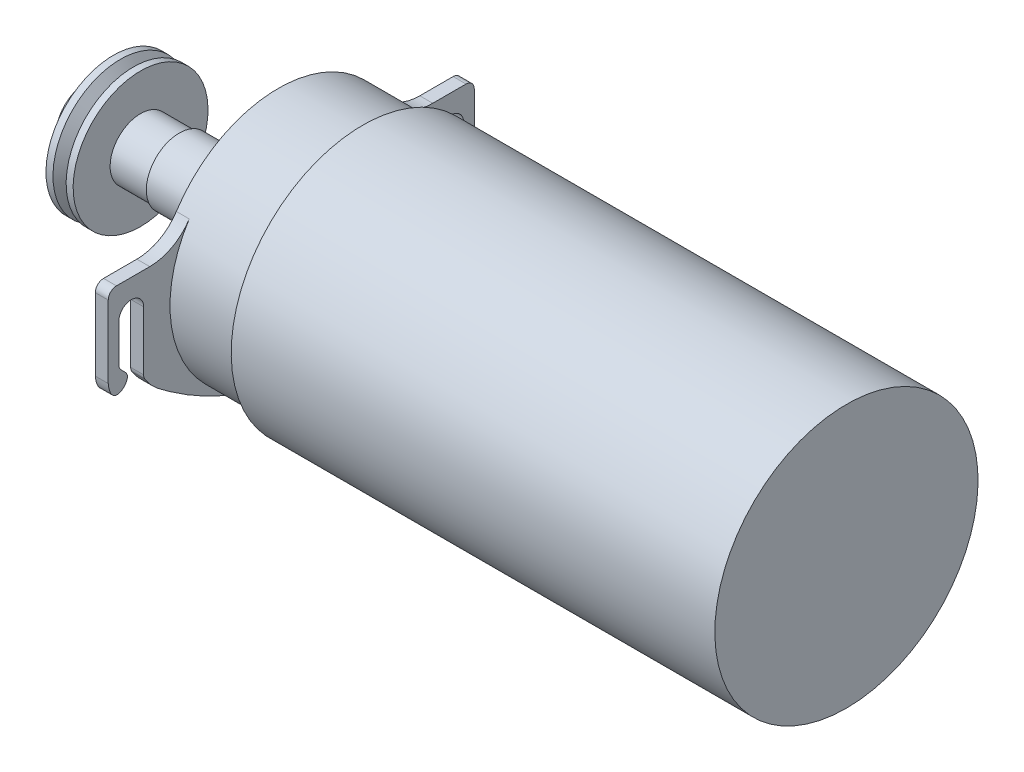
from build123d import *

# Parameters (mm, degrees)
BOSS_EXTRUDE1_DEPTH = 3.9878


with BuildPart() as part:
    # Sketch1 → Revolve3 (revolve)
    with BuildSketch(Plane.XY, mode=Mode.PRIVATE) as revolve3_sk:
        Polygon((65.88246304, 0.116454427), (65.88246304, 40.756454427), (-83.46953696, 40.756454427), (-83.46953696, 37.556054427), (-109.55533696, 37.556054427), (-109.55533696, 10.276454427), (-140.16233696, 10.276454427), (-140.16233696, 9.514454427), (-152.10033696, 9.514454427), (-152.10033696, 20.944454427), (-154.25933696, 20.944454427), (-156.29133696, 17.896454427), (-158.32333696, 20.944454427), (-160.48233696, 20.944454427), (-160.48233696, 9.514454427), (-162.64133696, 9.514454427), (-164.67333696, 6.466454427), (-166.70533696, 9.514454427), (-168.86433696, 9.514454427), (-168.86433696, 0.116454427), align=None)
    revolve(revolve3_sk.sketch.rotate(Axis((-168.86433696, 0.116454427, 0), (1, 0, 0)), 180), axis=Axis((-168.86433696, 0.116454427, 0), (1, 0, 0)))

    # Sketch3 → Boss-Extrude1 (add)
    with BuildSketch(Plane.ZY.offset(109.55533696)):
        with BuildLine():
            Line((43.68878247, 13.702640012), (53.975, 13.702640012))
            ThreePointArc((53.975, 13.702640012), (55.771051224, 12.958691236), (56.515, 11.162640012))
            Line((56.515, 11.162640012), (56.515, -11.153855692))
            add(Edge.make_bspline(
                [(56.515, -11.153855692), (55.734670507, -18.980740225), (46.838290405, -11.919148259), (53.258412532, -9.584126469), (53.213, -7.836402131)],
                knots=[0, 0, 0, 0, 0.643468678, 1, 1, 1, 1], degree=3))
            Line((53.213, -7.836402131), (53.213, 3.905256993))
            ThreePointArc((53.213, 3.905256993), (49.403, 7.715256993), (45.593, 3.905256993))
            Line((45.593, 3.905256993), (45.593, -14.276208246))
            ThreePointArc((45.593, -14.276208246), (45.497523844, -14.966065604), (45.21827309, -15.604060815))
            add(Edge.make_bspline(
                [(45.21827309, -15.604060815), (43.450296459, -18.48702562), (32.758547283, -26.592162263), (21.785194585, -32.669841259), (10.075949561, -35.941816311)],
                knots=[0.01574085, 0.01574085, 0.01574085, 0.01574085, 0.236596649, 1, 1, 1, 1], degree=3))
            ThreePointArc((10.075949561, -35.941816311), (0, -37.323145573), (-10.075949561, -35.941816311))
            add(Edge.make_bspline(
                [(-45.21827309, -15.604060815), (-43.450296459, -18.48702562), (-32.758547283, -26.592162263), (-21.785194585, -32.669841259), (-10.075949561, -35.941816311)],
                knots=[0.01574085, 0.01574085, 0.01574085, 0.01574085, 0.236596649, 1, 1, 1, 1], degree=3))
            ThreePointArc((-45.21827309, -15.604060815), (-45.497523844, -14.966065604), (-45.593, -14.276208246))
            Line((-45.593, -14.276208246), (-45.593, 3.905256993))
            ThreePointArc((-45.593, 3.905256993), (-49.403, 7.715256993), (-53.213, 3.905256993))
            Line((-53.213, 3.905256993), (-53.213, -7.836402131))
            add(Edge.make_bspline(
                [(-56.515, -11.153855692), (-55.734670507, -18.980740225), (-46.838290405, -11.919148259), (-53.258412532, -9.584126469), (-53.213, -7.836402131)],
                knots=[0, 0, 0, 0, 0.643468678, 1, 1, 1, 1], degree=3))
            Line((-56.515, -11.153855692), (-56.515, 11.162640012))
            ThreePointArc((-56.515, 11.162640012), (-55.771051224, 12.958691236), (-53.975, 13.702640012))
            Line((-53.975, 13.702640012), (-43.68878247, 13.702640012))
            ThreePointArc((-43.68878247, 13.702640012), (-36.742018611, 15.475534924), (-31.494435631, 20.360568941))
            ThreePointArc((-31.494435631, 20.360568941), (0, 37.556054427), (31.494435631, 20.360568941))
            ThreePointArc((31.494435631, 20.360568941), (36.742018611, 15.475534924), (43.68878247, 13.702640012))
        make_face()
    extrude(amount=-BOSS_EXTRUDE1_DEPTH)


solid = part.part
